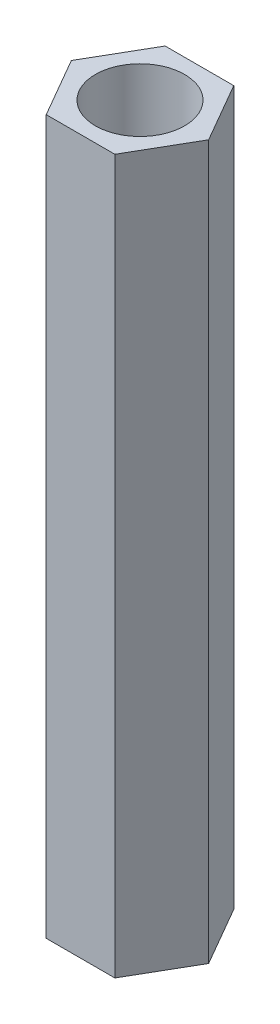
from build123d import *

# Parameters (mm, degrees)
SKETCH1_R           = 2.25
BOSS_EXTRUDE1_DEPTH = 36


with BuildPart() as part:
    # Sketch1 → Boss-Extrude1 (new body)
    with BuildSketch(Plane(origin=(0, 0, 0), x_dir=(1, 0, 0), z_dir=(0, 1, 0))):
        Polygon((1.732050808, -3), (3.464101615, 0), (1.732050808, 3), (-1.732050808, 3), (-3.464101615, 0), (-1.732050808, -3), align=None)
        with Locations(Location((0, 0, 0), (0, 0, 270))):
            Circle(SKETCH1_R, mode=Mode.SUBTRACT)
    extrude(amount=BOSS_EXTRUDE1_DEPTH)


solid = part.part
